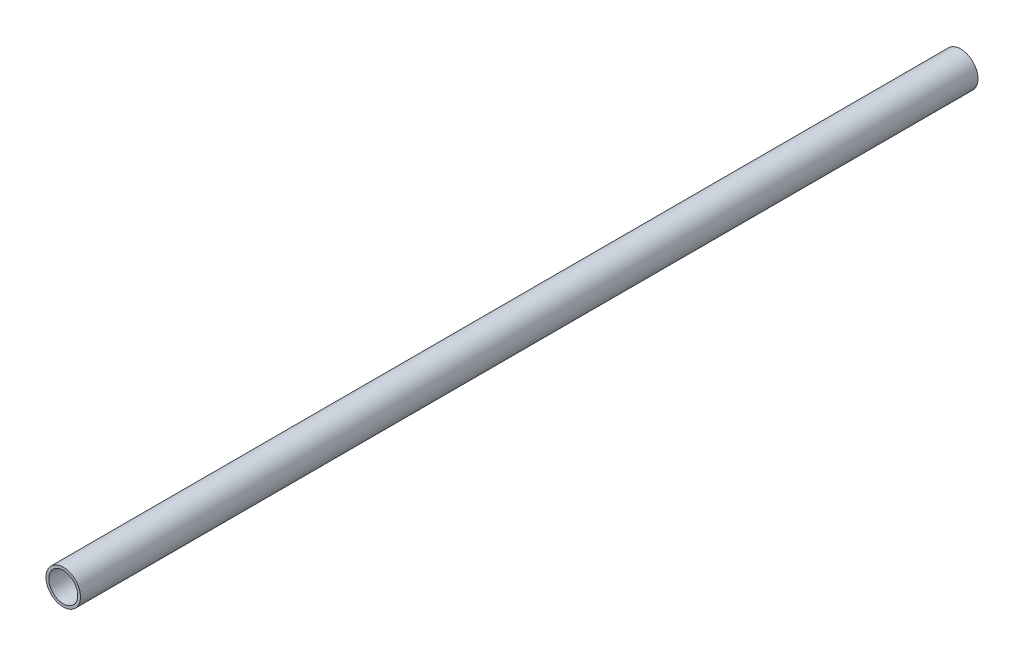
from build123d import *

# Parameters (mm, degrees)
CROQUIS1_R              = 12.5
CROQUIS1_R_2            = 10.5
SALIENTE_EXTRUIR1_DEPTH = 650


with BuildPart() as part:
    # Croquis1 → Saliente-Extruir1 (new body)
    with BuildSketch(Plane.XY):
        Circle(CROQUIS1_R)
        Circle(CROQUIS1_R_2, mode=Mode.SUBTRACT)
    extrude(amount=SALIENTE_EXTRUIR1_DEPTH)


solid = part.part
